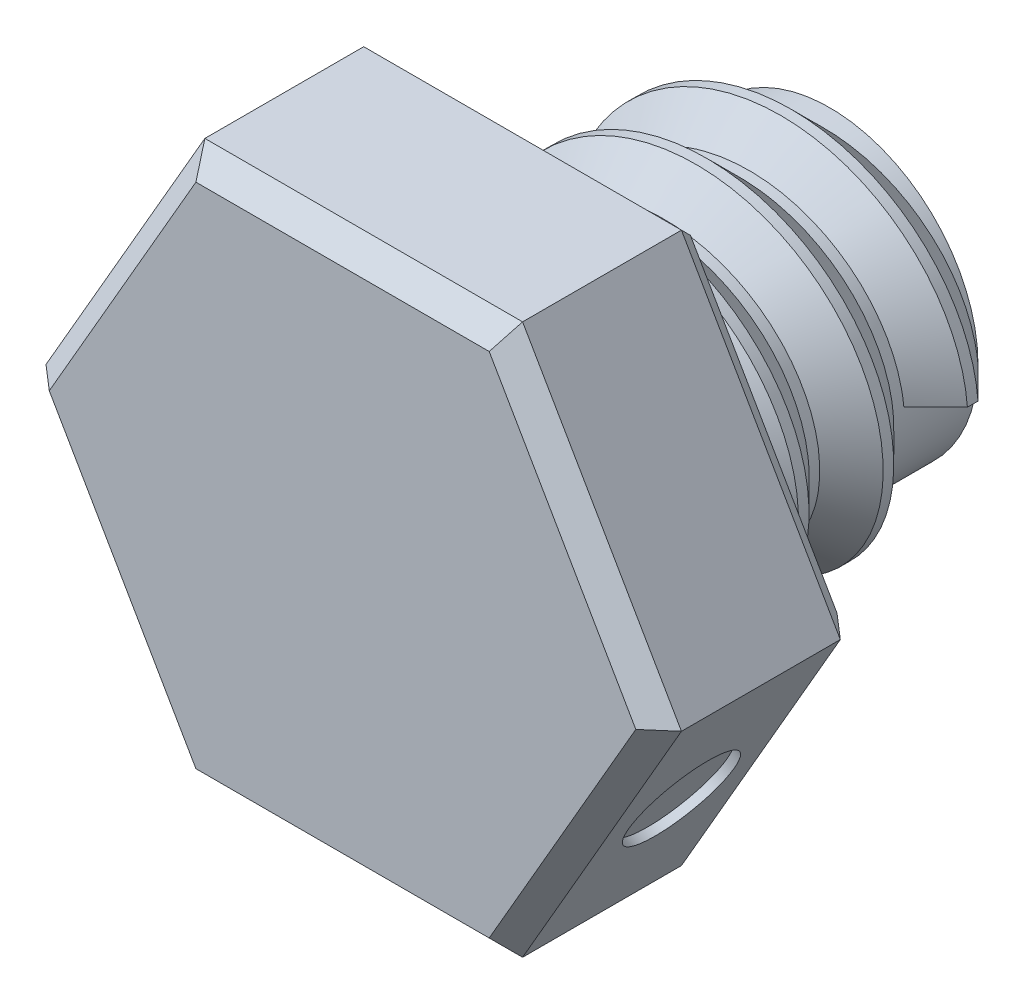
from build123d import *

# Parameters (mm, degrees)
EXTRUDE_1_DEPTH     = 9.5
SKETCH_6_R          = 7
EXTRUDE_2_DEPTH     = 13.5
SWEEP_1_PITCH       = 4
SWEEP_1_HEIGHT      = 10
SWEEP_1_RADIUS      = 7
REVOLVE_2_ANGLE     = 45
CHAMFER_1_SIZE      = 1
CUT_EXTRUDE_2_DEPTH = 0.4
SKETCH_13_R         = 2.5
CUT_EXTRUDE_3_DEPTH = 0.4
CUT_EXTRUDE_4_DEPTH = 0.4
SKETCH_14_W         = 5
SKETCH_14_H         = 5
CUT_EXTRUDE_5_DEPTH = 0.4


with BuildPart() as part:
    # 草图1 → 凸台-拉伸1 (new body)
    with BuildSketch(Plane.XY):
        Polygon((15, 0), (7.5, 12.990381057), (-7.5, 12.990381057), (-15, 0), (-7.5, -12.990381057), (7.5, -12.990381057), align=None)
    extrude(amount=EXTRUDE_1_DEPTH)

    # 草图6 → 凸台-拉伸2 (add)
    with BuildSketch(Plane(origin=(0, 0, 0), x_dir=(-1, 0, 0), z_dir=(0, 0, -1))):
        Circle(SKETCH_6_R)
    extrude(amount=EXTRUDE_2_DEPTH)

    # 扫描1: sweep along a helix
    with BuildLine() as sweep_1_path:
        Helix(SWEEP_1_PITCH, SWEEP_1_HEIGHT, SWEEP_1_RADIUS, center=(0, 0, -1.75), direction=(0, 0, -1))
    # 草图8 → 扫描1 (sweep)
    with BuildSketch(Plane(origin=(0, 0, 0), x_dir=(1, 0, 0), z_dir=(0, 1, 0))):
        Polygon((-7, 3.5), (-7, 0), (-8.5, 1.5), (-8.5, 2), align=None)
    sweep(path=sweep_1_path.line, is_frenet=True)

    # 草图9 → 旋转2 (revolve)
    with BuildSketch(Plane(origin=(0, 0, 0), x_dir=(1, 0, 0), z_dir=(0, 1, 0))):
        Polygon((7, 3.5), (7, 0), (8.5, 1.5), (8.5, 2), align=None)
    revolve(axis=Axis((0, 0, 0), (0, 0, 1)), revolution_arc=REVOLVE_2_ANGLE)

    # 倒角1
    chamfer_1_edges = [part.edges().sort_by_distance(p)[0] for p in [
        (-11.25, 6.495190528, 9.5),
        (-11.25, -6.495190528, 9.5),
        (0, -12.990381057, 9.5),
        (11.25, -6.495190528, 9.5),
        (11.25, 6.495190528, 9.5),
        (11.25, -6.495190528, 0),
        (0, -12.990381057, 0),
        (-11.25, -6.495190528, 0),
        (-11.25, 6.495190528, 0),
        (0, 12.990381057, 0),
        (11.25, 6.495190528, 0),
        (0, 12.990381057, 9.5),
    ]]
    chamfer(chamfer_1_edges, length=CHAMFER_1_SIZE)

    # 草图11 → 切除-拉伸2 (cut)
    with BuildSketch(Plane(origin=(-11.25, -6.495190528, 0), x_dir=(0, 0, 1), z_dir=(-0.8660254037844389, -0.4999999999999995, 0))):
        Polygon((2.25, 0), (7.25, 2.886751346), (7.25, -2.886751346), align=None)
    extrude(amount=-CUT_EXTRUDE_2_DEPTH, mode=Mode.SUBTRACT)

    # 草图13 → 切除-拉伸3 (cut)
    with BuildSketch(Plane(origin=(11.25, -6.495190528, 0), x_dir=(0, 0, -1), z_dir=(0.8660254037844387, -0.5000000000000001, 0))):
        with Locations(Location((-4.75, 0, 0), (0, 0, 90))):
            Circle(SKETCH_13_R)
    extrude(amount=-CUT_EXTRUDE_3_DEPTH, mode=Mode.SUBTRACT)

    # 草图12 → 切除-拉伸4 (cut)
    with BuildSketch(Plane.XZ.offset(12.990381057)):
        Polygon((-2.5, 6.825735931), (2.075735931, 2.25), (2.5, 2.674264069), (-2.075735931, 7.25), align=None)
        Polygon((2.075735931, 7.25), (-2.5, 2.674264069), (-2.075735931, 2.25), (2.5, 6.825735931), align=None)
    extrude(amount=-CUT_EXTRUDE_4_DEPTH, mode=Mode.SUBTRACT)

    # 草图14 → 切除-拉伸5 (cut)
    with BuildSketch(Plane(origin=(-11.25, 6.495190528, 0), x_dir=(0, 0, 1), z_dir=(-0.8660254037844384, 0.5000000000000006, 0))):
        with Locations((4.75, 0)):
            Rectangle(SKETCH_14_W, SKETCH_14_H)
    extrude(amount=-CUT_EXTRUDE_5_DEPTH, mode=Mode.SUBTRACT)


solid = part.part
